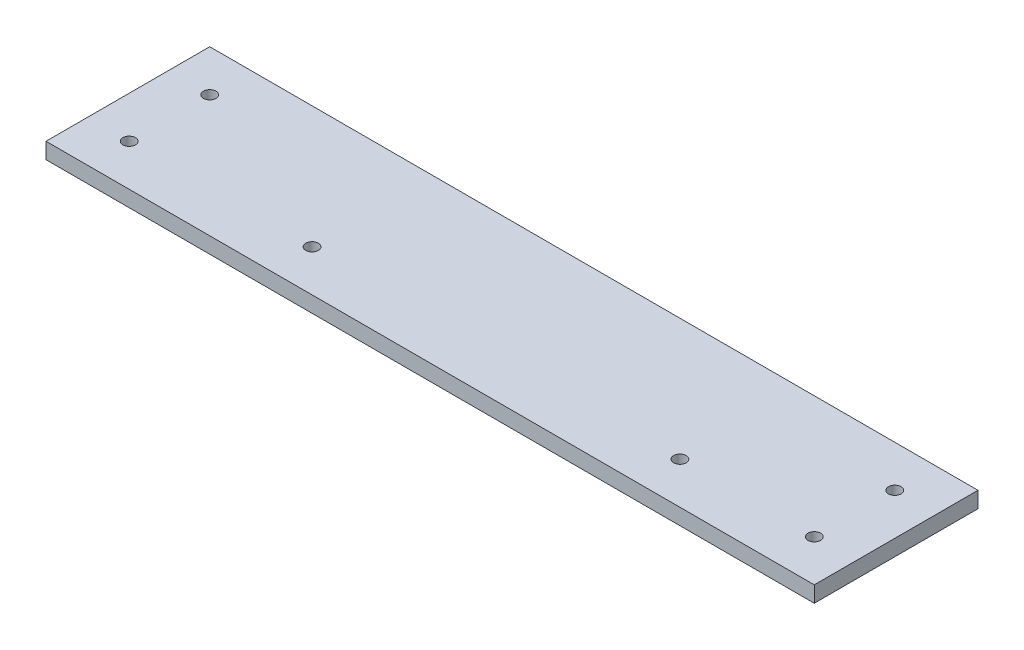
from build123d import *

# Parameters (mm, degrees)
SKETCH1_W               = 305
SKETCH1_H               = 65
BOSS_EXTRUDE1_DEPTH     = 3.175
SKETCH4_R               = 2.5
CUT_EXTRUDE2_DEPTH      = 159.40243251
CUT_EXTRUDE3_DEPTH      = 157.053908955
CUT_EXTRUDE3_DEPTH_BACK = 157.053908955
SKETCH5_R               = 2.5


with BuildPart() as part:
    # Sketch1 → Boss-Extrude1 (new, symmetric)
    with BuildSketch(Plane(origin=(0, 0, 0), x_dir=(1, 0, 0), z_dir=(0, 1, 0))):
        Rectangle(SKETCH1_W, SKETCH1_H)
    extrude(amount=BOSS_EXTRUDE1_DEPTH, both=True)

    # Sketch4 → Cut-Extrude2 (cut, symmetric)
    with BuildSketch(Plane(origin=(-2.5, 0, 0), x_dir=(-1, 0, 0), z_dir=(0, -1, 0))):
        with Locations(Location((133.48, -15.98, 0), (0, 0, 90))):
            Circle(SKETCH4_R)
        with Locations(Location((133.48, 15.98, 0), (0, 0, 270))):
            Circle(SKETCH4_R)
    cut_extrude2 = extrude(amount=CUT_EXTRUDE2_DEPTH, both=True, mode=Mode.SUBTRACT)

    # Mirror2: Cut-Extrude2 across plane
    add(cut_extrude2.mirror(Plane(origin=(0, 0, 0), x_dir=(0, 0, 1), z_dir=(1, 0, 0))), mode=Mode.SUBTRACT)

    # Sketch5 → Cut-Extrude3 (cut, two sides: drawn at the far end of the back side and taken through both)
    with BuildSketch(Plane(origin=(0, 3.175, 0), x_dir=(1, 0, 0), z_dir=(0, 1, 0)).offset(-CUT_EXTRUDE3_DEPTH_BACK)):
        with Locations(Location((82.64, -15.98, 0), (0, 0, 270))):
            Circle(SKETCH5_R)
        with Locations(Location((-63.41, -15.98, 0), (0, 0, 270))):
            Circle(SKETCH5_R)
    extrude(amount=CUT_EXTRUDE3_DEPTH + CUT_EXTRUDE3_DEPTH_BACK, mode=Mode.SUBTRACT)


solid = part.part
